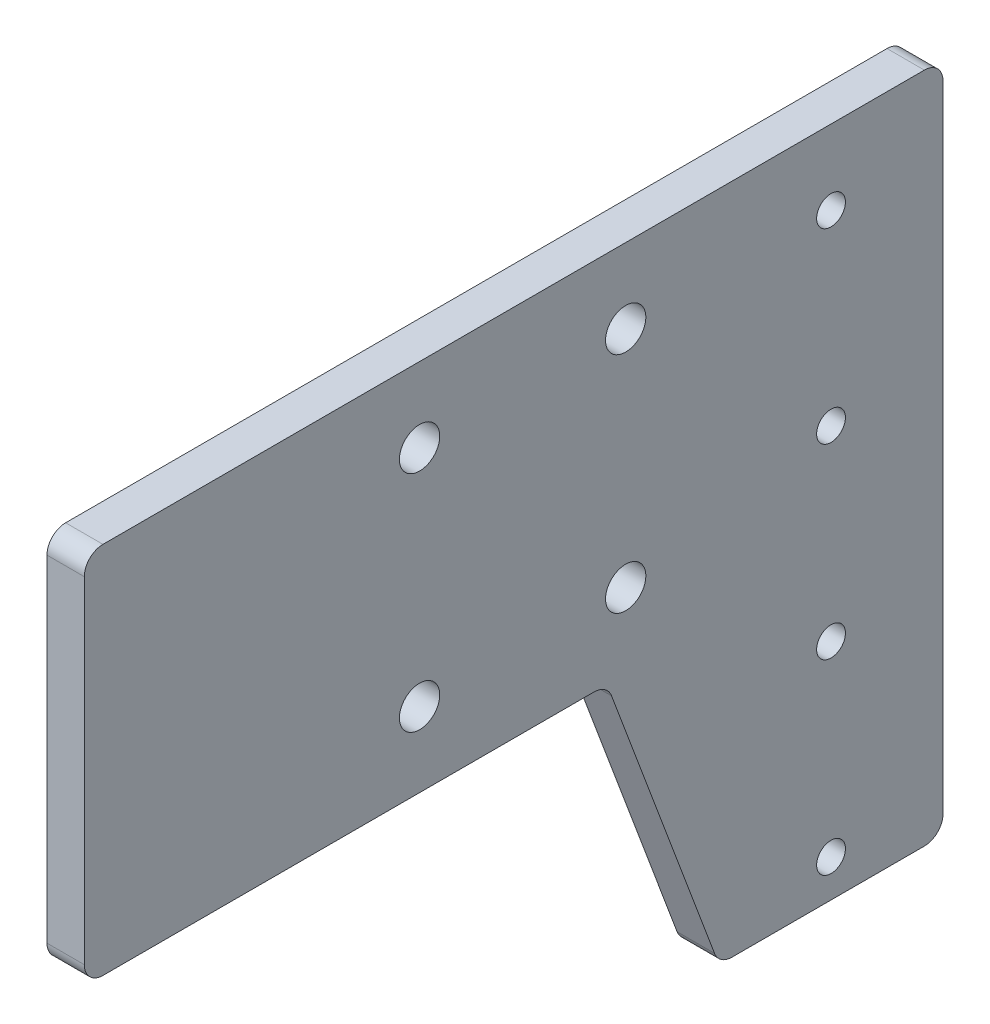
from build123d import *

# Parameters (mm, degrees)
SKETCH1_R           = 2.4511
SKETCH1_R_2         = 3.429
BOSS_EXTRUDE1_DEPTH = 6.35
FILLET1_R           = 3.175


with BuildPart() as part:
    # Sketch1 → Boss-Extrude1 (new body)
    with BuildSketch(Plane(origin=(0, 0, 0), x_dir=(0, 0, -1), z_dir=(1, 0, 0))):
        Polygon((0, 0), (-38.1, 0), (-57.15, 50.8), (-146.05, 50.8), (-146.05, 114.3), (0, 114.3), align=None)
        with Locations((-19.05, 101.6)):
            Circle(SKETCH1_R, mode=Mode.SUBTRACT)
        with Locations((-19.05, 69.85)):
            Circle(SKETCH1_R, mode=Mode.SUBTRACT)
        with Locations((-19.05, 38.1)):
            Circle(SKETCH1_R, mode=Mode.SUBTRACT)
        with Locations((-19.05, 6.35)):
            Circle(SKETCH1_R, mode=Mode.SUBTRACT)
        with Locations((-53.975, 101.6)):
            Circle(SKETCH1_R_2, mode=Mode.SUBTRACT)
        with Locations((-89.027, 101.6)):
            Circle(SKETCH1_R_2, mode=Mode.SUBTRACT)
        with Locations((-89.027, 63.5)):
            Circle(SKETCH1_R_2, mode=Mode.SUBTRACT)
        with Locations((-53.975, 63.5)):
            Circle(SKETCH1_R_2, mode=Mode.SUBTRACT)
    extrude(amount=BOSS_EXTRUDE1_DEPTH)

    # Fillet1
    fillet1_edges = [part.edges().sort_by_distance(p)[0] for p in [
        (3.175, 0, 0),
        (3.175, 0, 38.1),
        (3.175, 50.8, 57.15),
        (3.175, 50.8, 146.05),
        (3.175, 114.3, 146.05),
        (3.175, 114.3, 0),
    ]]
    fillet(fillet1_edges, radius=FILLET1_R)


solid = part.part
